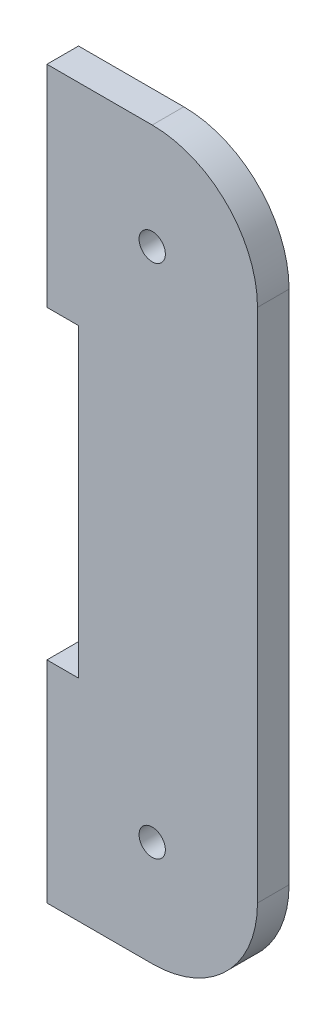
from build123d import *

# Parameters (mm, degrees)
SKETCH_1_W          = 20
SKETCH_1_H          = 69
EXTRUDE_1_DEPTH     = 3
SKETCH_2_W          = 3
SKETCH_2_H          = 29
CUT_EXTRUDE_1_DEPTH = 3
HOLE_WIZARD_M3_1_D  = 2.5
FILLET_1_R          = 10


with BuildPart() as part:
    # 草图1 → 凸台-拉伸1 (new body)
    with BuildSketch(Plane.XY):
        with Locations((-0.204081633, 19.551020408)):
            Rectangle(SKETCH_1_W, SKETCH_1_H)
    extrude(amount=EXTRUDE_1_DEPTH)

    # 草图2 → 切除-拉伸1 (cut)
    with BuildSketch(Plane.XY):
        with Locations((-8.704081633, 19.551020408)):
            Rectangle(SKETCH_2_W, SKETCH_2_H)
    extrude(amount=CUT_EXTRUDE_1_DEPTH, mode=Mode.SUBTRACT)

    # M3 螺纹孔的螺纹孔钻头1 (through all)
    with Locations(Plane(origin=(0, 0, 0), x_dir=(-1, 0, 0), z_dir=(0, 0, -1))):
        with Locations((0.204081633, 44.051020408), (0.204081633, -4.948979592)):
            Hole(HOLE_WIZARD_M3_1_D / 2)

    # 圆角1
    fillet_1_edges = [part.edges().sort_by_distance(p)[0] for p in [
        (9.795918367, 54.051020408, 1.5),
        (9.795918367, -14.948979592, 1.5),
    ]]
    fillet(fillet_1_edges, radius=FILLET_1_R)


solid = part.part
